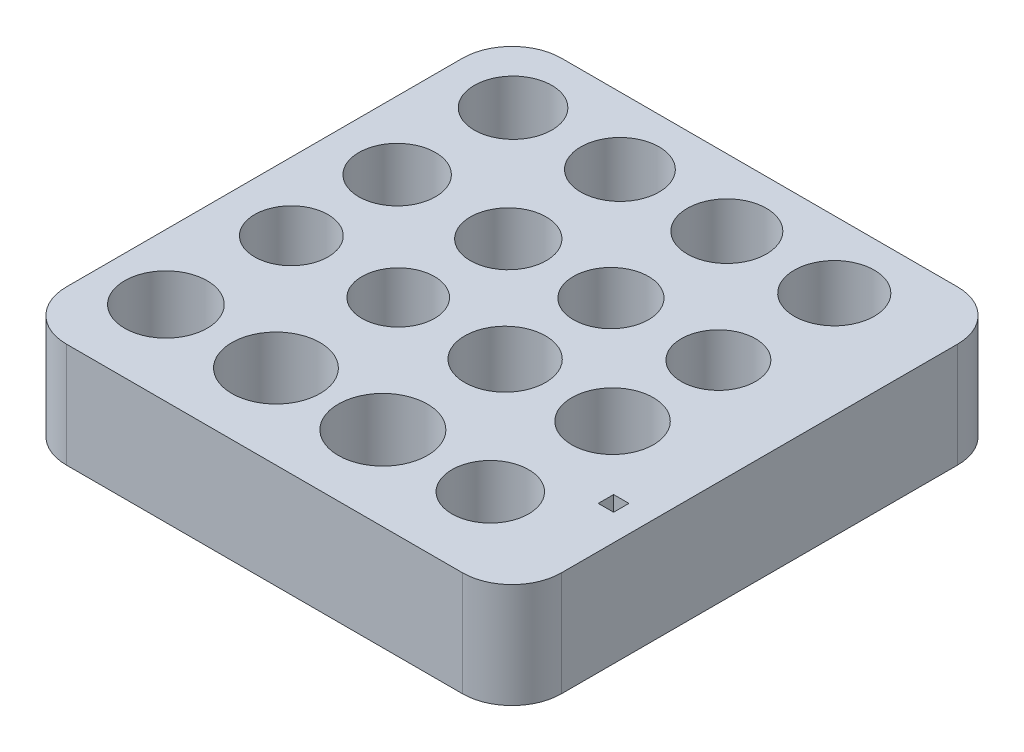
from build123d import *

# Parameters (mm, degrees)
BOSS_EXTRUDE1_DEPTH = 6.35
SKETCH2_R           = 2.35
SKETCH2_R_2         = 2.4
SKETCH2_R_3         = 2.325
SKETCH2_R_4         = 2.275
SKETCH2_R_5         = 2.375
SKETCH2_R_6         = 2.425
SKETCH2_R_7         = 2.3
SKETCH2_R_8         = 2.25
SKETCH2_R_9         = 2.225
SKETCH2_R_10        = 2.2
SKETCH2_R_11        = 2.45
SKETCH2_R_12        = 2.475
SKETCH2_R_13        = 2.5
SKETCH2_R_14        = 2.675
SKETCH2_R_15        = 2.7
SKETCH2_W           = 0.929848637
SKETCH2_H           = 0.929848637
CUT_EXTRUDE1_DEPTH  = 6.35


with BuildPart() as part:
    # Sketch1 → Boss-Extrude1 (new body)
    with BuildSketch(Plane(origin=(0, 0, 0), x_dir=(1, 0, 0), z_dir=(0, 1, 0))):
        with BuildLine():
            Line((3, 0), (27, 0))
            ThreePointArc((27, 0), (29.121320344, 0.878679656), (30, 3))
            Line((30, 3), (30, 27))
            ThreePointArc((30, 27), (29.121320344, 29.121320344), (27, 30))
            Line((27, 30), (3, 30))
            ThreePointArc((3, 30), (0.878679656, 29.121320344), (0, 27))
            Line((0, 27), (0, 3))
            ThreePointArc((0, 3), (0.878679656, 0.878679656), (3, 0))
        make_face()
    extrude(amount=BOSS_EXTRUDE1_DEPTH)

    # Sketch2 → Cut-Extrude1 (cut)
    with BuildSketch(Plane(origin=(0, 6.35, 0), x_dir=(1, 0, 0), z_dir=(0, 1, 0))):
        with Locations(Location((4.130390075, 25.933737418, 0), (0, 0, 270))):
            Circle(SKETCH2_R)
        with Locations(Location((17.084143496, 25.933737418, 0), (0, 0, 270))):
            Circle(SKETCH2_R_2)
        with Locations(Location((4.130390075, 18.911777023, 0), (0, 0, 270))):
            Circle(SKETCH2_R_3)
        with Locations(Location((17.084143496, 18.911777023, 0), (0, 0, 270))):
            Circle(SKETCH2_R_4)
        with Locations(Location((10.607266785, 25.933737418, 0), (0, 0, 270))):
            Circle(SKETCH2_R_5)
        with Locations(Location((23.593083953, 25.933737418, 0), (0, 0, 270))):
            Circle(SKETCH2_R_6)
        with Locations(Location((10.863776754, 18.911777023, 0), (0, 0, 270))):
            Circle(SKETCH2_R_7)
        with Locations(Location((23.593083953, 18.911777023, 0), (0, 0, 270))):
            Circle(SKETCH2_R_8)
        with Locations(Location((4.130390075, 12.499027805, 0), (0, 0, 270))):
            Circle(SKETCH2_R_9)
        with Locations(Location((10.607266785, 12.499027805, 0), (0, 0, 270))):
            Circle(SKETCH2_R_10)
        with Locations(Location((17.084143496, 12.499027805, 0), (0, 0, 270))):
            Circle(SKETCH2_R_11)
        with Locations(Location((23.593083953, 12.499027805, 0), (0, 0, 270))):
            Circle(SKETCH2_R_12)
        with Locations(Location((3.938007598, 5.092302457, 0), (0, 0, 270))):
            Circle(SKETCH2_R_13)
        with Locations(Location((10.607266785, 5.092302457, 0), (0, 0, 270))):
            Circle(SKETCH2_R_14)
        with Locations(Location((17.084143496, 5.092302457, 0), (0, 0, 270))):
            Circle(SKETCH2_R_15)
        with Locations(Location((23.593083953, 5.092302457, 0), (0, 0, 270))):
            Circle(SKETCH2_R_3)
        with Locations((27.937721549, 8.218517702)):
            Rectangle(SKETCH2_W, SKETCH2_H)
    extrude(amount=-CUT_EXTRUDE1_DEPTH, mode=Mode.SUBTRACT)


solid = part.part
